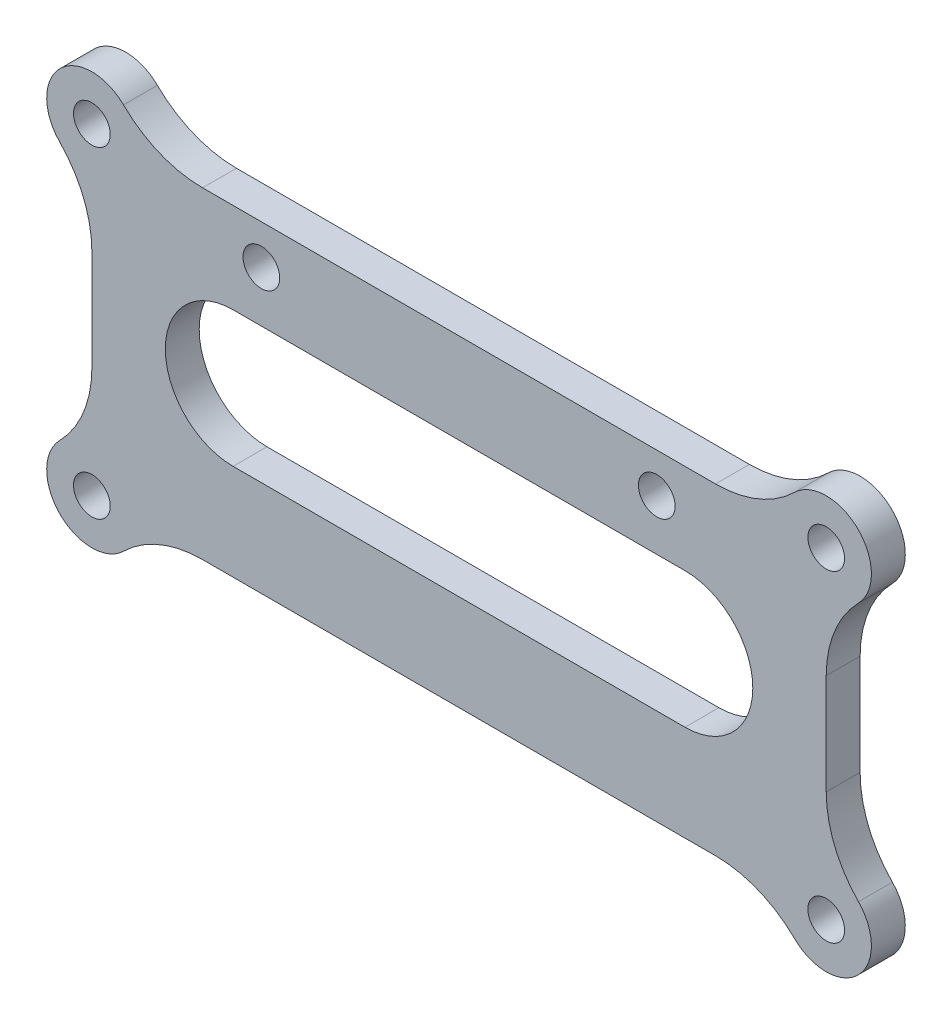
from build123d import *

# Parameters (mm, degrees)
SKETCH_1_R          = 1.625
EXTRUDE_1_DEPTH     = 3
FILLET_1_R          = 10
SKETCH_3_R          = 1.625
CUT_EXTRUDE_1_DEPTH = 10
CUT_EXTRUDE_4_DEPTH = 10


with BuildPart() as part:
    # Эскиз1 → Бобышка-Вытянуть1 (new body)
    with BuildSketch(Plane.XY):
        with BuildLine():
            ThreePointArc((-32.5, 4), (-35.328427125, -2.828427125), (-28.5, 0))
            Line((-28.5, 0), (28.5, 0))
            ThreePointArc((28.5, 0), (35.328427125, -2.828427125), (32.5, 4))
            Line((32.5, 4), (32.5, 24.5))
            ThreePointArc((32.5, 24.5), (35.328427125, 31.328427125), (28.5, 28.5))
            Line((28.5, 28.5), (-28.5, 28.5))
            ThreePointArc((-28.5, 28.5), (-35.328427125, 31.328427125), (-32.5, 24.5))
            Line((-32.5, 24.5), (-32.5, 4))
        make_face()
        with Locations((-32.5, 0)):
            Circle(SKETCH_1_R, mode=Mode.SUBTRACT)
        with Locations((32.5, 28.5)):
            Circle(SKETCH_1_R, mode=Mode.SUBTRACT)
        with Locations((-32.5, 28.5)):
            Circle(SKETCH_1_R, mode=Mode.SUBTRACT)
        with Locations((32.5, 0)):
            Circle(SKETCH_1_R, mode=Mode.SUBTRACT)
    extrude(amount=EXTRUDE_1_DEPTH)

    # Скругление1
    fillet_1_edges = [part.edges().sort_by_distance(p)[0] for p in [
        (28.5, 0, 1.5),
        (-28.5, 0, 1.5),
        (-32.5, 4, 1.5),
        (-32.5, 24.5, 1.5),
        (-28.5, 28.5, 1.5),
        (28.5, 28.5, 1.5),
        (32.5, 24.5, 1.5),
        (32.5, 4, 1.5),
    ]]
    fillet(fillet_1_edges, radius=FILLET_1_R)

    # Эскиз3 → Вырез-Вытянуть1 (cut)
    with BuildSketch(Plane(origin=(0, 0, 0), x_dir=(-1, 0, 0), z_dir=(0, 0, -1))):
        with Locations((-17.5, 25)):
            Circle(SKETCH_3_R)
        with Locations(Location((17.5, 25, 0), (0, 0, 180))):
            Circle(SKETCH_3_R)
    extrude(amount=-CUT_EXTRUDE_1_DEPTH, mode=Mode.SUBTRACT)

    # Эскиз8 → Вырез-Вытянуть4 (cut)
    with BuildSketch(Plane(origin=(0, 0, 0), x_dir=(-1, 0, 0), z_dir=(0, 0, -1))):
        with BuildLine():
            Line((-20, 20.5), (20, 20.5))
            ThreePointArc((20, 20.5), (26, 14.5), (20, 8.5))
            Line((20, 8.5), (-20, 8.5))
            ThreePointArc((-20, 8.5), (-26, 14.5), (-20, 20.5))
        make_face()
    extrude(amount=-CUT_EXTRUDE_4_DEPTH, mode=Mode.SUBTRACT)


solid = part.part
